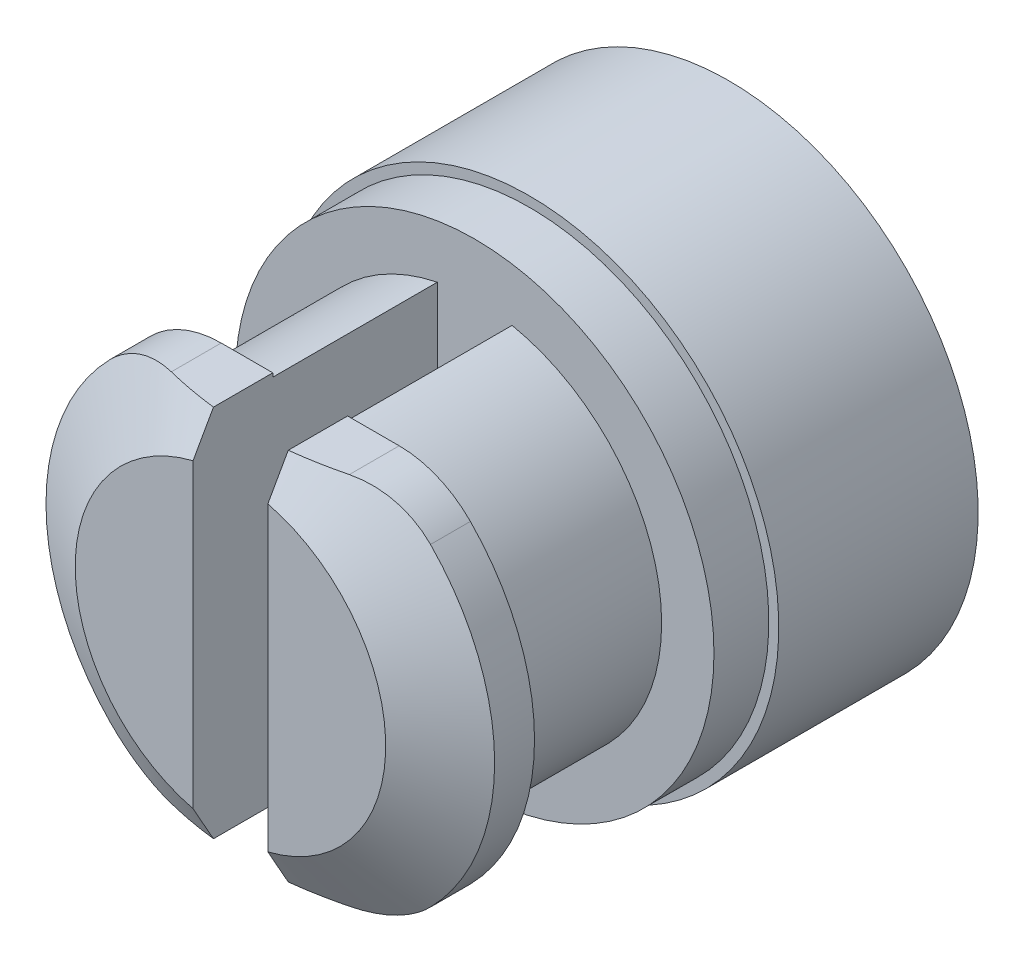
from build123d import *
from OCP.BRepFilletAPI import BRepFilletAPI_MakeChamfer

# Parameters (mm, degrees)
SKETCH1_R           = 2.4
BOSS_EXTRUDE1_DEPTH = 0.55
SKETCH2_R           = 1.875
BOSS_EXTRUDE2_DEPTH = 1.65
SKETCH3_R           = 2.5
BOSS_EXTRUDE3_DEPTH = 2
SKETCH4_R           = 2.25
BOSS_EXTRUDE4_DEPTH = 0.8
CUT_EXTRUDE1_REACH  = 8.124
SKETCH5_W           = 0.75
SKETCH5_H           = 6.07376998
CHAMFER1_SIZE       = 0.4
CHAMFER1_SIZE2      = 0.692820323
SKETCH6_W           = 6.999273813
SKETCH6_H           = 5.334981493
SKETCH6_W_2         = 6.558585844
SKETCH6_H_2         = 3.75
CUT_EXTRUDE3_DEPTH  = 2
FILLET2_R           = 1
SKETCH7_R           = 1
CUT_EXTRUDE4_DEPTH  = 2


with BuildPart() as part:
    # Sketch1 → Boss-Extrude1 (new body)
    with BuildSketch(Plane.XY):
        Circle(SKETCH1_R)
    extrude(amount=BOSS_EXTRUDE1_DEPTH)

    # Sketch2 → Boss-Extrude2 (add)
    with BuildSketch(Plane.XY.offset(0.55)):
        Circle(SKETCH2_R)
    extrude(amount=BOSS_EXTRUDE2_DEPTH)

    # Sketch3 → Boss-Extrude3 (add)
    with BuildSketch(Plane(origin=(0, 0, 0), x_dir=(-1, 0, 0), z_dir=(0, 0, -1))):
        Circle(SKETCH3_R)
    extrude(amount=BOSS_EXTRUDE3_DEPTH)

    # Sketch4 → Boss-Extrude4 (add)
    with BuildSketch(Plane.XY.offset(2.2)):
        Circle(SKETCH4_R)
    extrude(amount=BOSS_EXTRUDE4_DEPTH)

    # Cut-Extrude1: up to this face of the body (flat: up to its plane)
    cut_extrude1_end = Plane(part.part.faces().sort_by_distance((-2.332117749, 0, 0.55))[0])
    # Sketch5 → Cut-Extrude1 (cut, up to the picked face)
    with BuildSketch(Plane.XY.offset(3), mode=Mode.PRIVATE) as cut_extrude1_sk1:
        Rectangle(SKETCH5_W, SKETCH5_H)
    cut_extrude1_tool1 = split(extrude(cut_extrude1_sk1.sketch, amount=-CUT_EXTRUDE1_REACH, mode=Mode.PRIVATE), bisect_by=cut_extrude1_end, keep=Keep.BOTH, mode=Mode.PRIVATE)
    add(cut_extrude1_tool1.solids().sort_by(Axis((0, 0, 3), (0, 0, -1)))[0], mode=Mode.SUBTRACT)

    # Chamfer1: one chamfer whose edges measure the first distance from different faces: ONE call of the kernel's chamfer builder (chamfer() names one face for all edges)
    chamfer1_edges_1 = [part.edges().sort_by_distance(p)[0] for p in [
        (-2.25, 0, 3),
    ]]
    chamfer1_side_1 = [part.faces().sort_by_distance(p)[0] for p in [
        (-2.25, 0, 2.6),
    ]]
    chamfer1_edges_2 = [part.edges().sort_by_distance(p)[0] for p in [
        (2.25, 0, 3),
    ]]
    chamfer1_side_2 = [part.faces().sort_by_distance(p)[0] for p in [
        (2.25, 0, 2.6),
    ]]
    chamfer1 = BRepFilletAPI_MakeChamfer(part.part.solid().wrapped)
    for e in chamfer1_edges_1:
        chamfer1.Add(CHAMFER1_SIZE, CHAMFER1_SIZE2, e.wrapped, chamfer1_side_1[0].wrapped)  # the first distance lies on this face
    for e in chamfer1_edges_2:
        chamfer1.Add(CHAMFER1_SIZE, CHAMFER1_SIZE2, e.wrapped, chamfer1_side_2[0].wrapped)  # the first distance lies on this face
    add(Compound.cast(chamfer1.Shape()), mode=Mode.REPLACE)

    # Sketch6 → Cut-Extrude3 (cut)
    with BuildSketch(Plane.XY.offset(3)):
        with Locations((0.047792, -0.043471688)):
            Rectangle(SKETCH6_W, SKETCH6_H)
        Rectangle(SKETCH6_W_2, SKETCH6_H_2, mode=Mode.SUBTRACT)
    extrude(amount=-CUT_EXTRUDE3_DEPTH, mode=Mode.SUBTRACT)

    # Fillet2
    fillet2_edges = [part.edges().sort_by_distance(p)[0] for p in [
        (-1.243734296, 1.875, 2.4),
        (1.243734296, 1.875, 2.4),
        (-1.243734296, -1.875, 2.4),
        (1.243734296, -1.875, 2.4),
    ]]
    fillet(fillet2_edges, radius=FILLET2_R)

    # Sketch7 → Cut-Extrude4 (cut)
    with BuildSketch(Plane(origin=(0, 0, -2), x_dir=(-1, 0, 0), z_dir=(0, 0, -1))):
        Circle(SKETCH7_R)
    extrude(amount=-CUT_EXTRUDE4_DEPTH, mode=Mode.SUBTRACT)


solid = part.part
